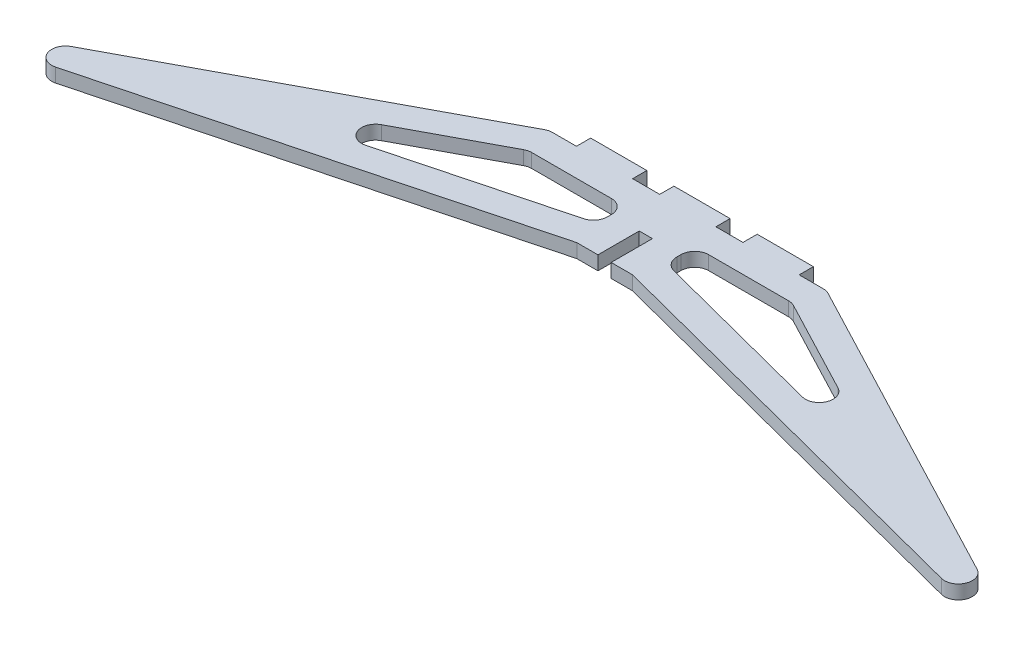
from build123d import *

# Parameters (mm, degrees)
BOSS_EXTRUDE1_DEPTH = 3.175


with BuildPart() as part:
    # Sketch2 → Boss-Extrude1 (new body)
    with BuildSketch(Plane(origin=(0, 0, 0), x_dir=(1, 0, 0), z_dir=(0, 1, 0))):
        with BuildLine():
            Line((-1.5113, -19.05), (-1.5113, -9.6012))
            Line((-1.5113, -9.6012), (1.5113, -9.6012))
            Line((1.5113, -9.6012), (1.5113, -19.05))
            Line((1.5113, -19.05), (6.35, -19.05))
            Line((6.35, -19.05), (101.892440563, -43.858854449))
            ThreePointArc((101.892440563, -43.858854449), (105.652252874, -41.929489283), (104.164919451, -37.973926385))
            Line((104.164919451, -37.973926385), (32.442533737, -0.363160318))
            ThreePointArc((32.442533737, -0.363160318), (31.727309935, -0.092126666), (30.968022767, 0))
            Line((30.968022767, 0), (25.4762, 0))
            Line((25.4762, 0), (25.4762, 3.2512))
            Line((25.4762, 3.2512), (12.6238, 3.2512))
            Line((12.6238, 3.2512), (12.6238, 0))
            Line((12.6238, 0), (6.4262, 0))
            Line((6.4262, 0), (6.4262, 3.2512))
            Line((6.4262, 3.2512), (-6.4262, 3.2512))
            Line((-6.4262, 3.2512), (-6.4262, 0))
            Line((-6.4262, 0), (-12.6238, 0))
            Line((-12.6238, 0), (-12.6238, 3.2512))
            Line((-12.6238, 3.2512), (-25.4762, 3.2512))
            Line((-25.4762, 3.2512), (-25.4762, 0))
            Line((-25.4762, 0), (-30.95625, 0))
            ThreePointArc((-30.95625, 0), (-31.726300609, -0.094797562), (-32.450367647, -0.373529412))
            Line((-32.450367647, -0.373529412), (-103.023886624, -38.012739533))
            ThreePointArc((-103.023886624, -38.012739533), (-104.485708905, -41.973107934), (-100.721752751, -43.884671777))
            Line((-100.721752751, -43.884671777), (-6.35, -19.05))
            Line((-6.35, -19.05), (-1.5113, -19.05))
        make_face()
        with BuildLine():
            Line((-52.083424577, -18.041159774), (-30.862867647, -6.723529412))
            ThreePointArc((-30.862867647, -6.723529412), (-30.138800609, -6.444797562), (-29.36875, -6.35))
            Line((-29.36875, -6.35), (-11.126341516, -6.35))
            ThreePointArc((-11.126341516, -6.35), (-8.876399737, -7.28482434), (-7.951371556, -9.538811345))
            Line((-7.951371556, -9.538811345), (-7.955433254, -10.472519677))
            ThreePointArc((-7.955433254, -10.472519677), (-8.620060106, -12.402622549), (-10.322386989, -13.529169988))
            Line((-10.322386989, -13.529169988), (-49.781290705, -23.913092018))
            ThreePointArc((-49.781290705, -23.913092018), (-53.545246858, -22.001528175), (-52.083424577, -18.041159774))
        make_face(mode=Mode.SUBTRACT)
        with BuildLine():
            Line((7.941592001, -9.529086738), (7.942778948, -10.451228904))
            ThreePointArc((7.942778948, -10.451228904), (8.607635671, -12.39131781), (10.3198084, -13.520230548))
            Line((10.3198084, -13.520230548), (50.025691322, -23.830386583))
            ThreePointArc((50.025691322, -23.830386583), (53.785503632, -21.901021417), (52.29817021, -17.945458519))
            Line((52.29817021, -17.945458519), (30.878579271, -6.713160318))
            ThreePointArc((30.878579271, -6.713160318), (30.163355469, -6.442126666), (29.404068301, -6.35))
            Line((29.404068301, -6.35), (11.116589371, -6.35))
            ThreePointArc((11.116589371, -6.35), (8.870080926, -7.281381315), (7.941592001, -9.529086738))
        make_face(mode=Mode.SUBTRACT)
    extrude(amount=BOSS_EXTRUDE1_DEPTH)


solid = part.part
